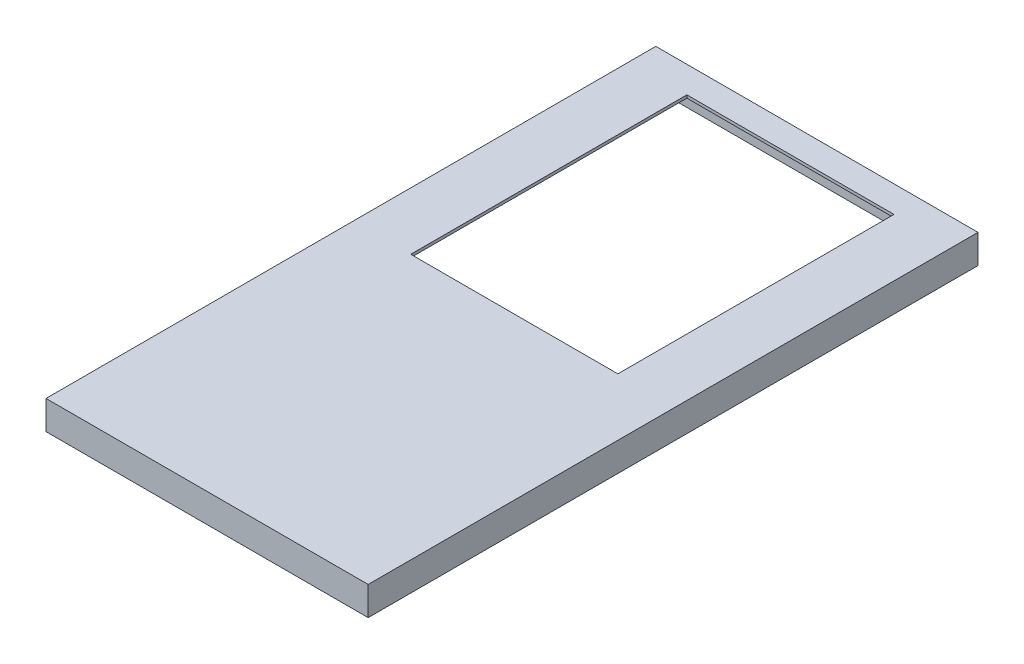
from build123d import *

# Parameters (mm, degrees)
SKETCH1_W                 = 56
SKETCH1_H                 = 106
BOSS_EXTRUDE1_DEPTH       = 5
SHELL1_T                  = -1.5
SHELL1_THICKNESS_2_FACE_W = 103
SHELL1_THICKNESS_2_FACE_H = 53
SHELL1_THICKNESS_2_DEPTH  = 1
SKETCH2_W                 = 36
SKETCH2_H                 = 48
CUT_EXTRUDE1_DEPTH        = 61.149812967
BOSS_EXTRUDE2_DEPTH       = 2.3
SKETCH4_R                 = 2.75
BOSS_EXTRUDE3_DEPTH       = 4.5
SKETCH5_R                 = 1.8
CUT_EXTRUDE2_DEPTH        = 4.5
MIRROR2_COPY_1_SKETCH_R   = 2.75
MIRROR2_COPY_1_DEPTH      = 4.5
MIRROR2_COPY_2_SKETCH_R   = 1.8
MIRROR2_COPY_2_DEPTH      = 4.5


with BuildPart() as part:
    # Sketch1 → Boss-Extrude1 (new body)
    with BuildSketch(Plane(origin=(0, 0, 0), x_dir=(1, 0, 0), z_dir=(0, 1, 0))):
        Rectangle(SKETCH1_W, SKETCH1_H)
    extrude(amount=-BOSS_EXTRUDE1_DEPTH)

    # Shell1
    shell1_openings = [part.faces().sort_by_distance(p)[0] for p in [
        (0, -5, 0),
    ]]
    offset(amount=SHELL1_T, openings=shell1_openings, kind=Kind.INTERSECTION)

    # Shell1 thickness 2 face (on inner face of the shell) → Shell1 thickness 2 (cut)
    with BuildSketch(Plane.ZX.offset(-1.5)):
        Rectangle(SHELL1_THICKNESS_2_FACE_W, SHELL1_THICKNESS_2_FACE_H)
    extrude(amount=SHELL1_THICKNESS_2_DEPTH, mode=Mode.SUBTRACT)

    # Sketch2 → Cut-Extrude1 (cut, through all)
    with BuildSketch(Plane(origin=(0, 0, 0), x_dir=(1, 0, 0), z_dir=(0, 1, 0))):
        with Locations((0, 24.4)):
            Rectangle(SKETCH2_W, SKETCH2_H)
    extrude(amount=-CUT_EXTRUDE1_DEPTH, mode=Mode.SUBTRACT)

    # Sketch3 → Boss-Extrude2 (add)
    with BuildSketch(Plane.XZ.offset(0.5)):
        Polygon((-21.6, -51.5), (21.6, -51.5), (21.6, 9.2), (18.1, 9.2), (18.1, 10.7), (23.1, 10.7), (23.1, -53), (-23.1, -53), (-23.1, 10.7), (-18.1, 10.7), (-18.1, 9.2), (-21.6, 9.2), align=None)
    extrude(amount=BOSS_EXTRUDE2_DEPTH)

    # Sketch4 → Boss-Extrude3 (add)
    with BuildSketch(Plane.XZ.offset(0.5)):
        with Locations((25.25, -50.25)):
            Circle(SKETCH4_R)
    boss_extrude3 = extrude(amount=BOSS_EXTRUDE3_DEPTH)

    # Sketch5 → Cut-Extrude2 (cut)
    with BuildSketch(Plane.XZ.offset(5)):
        with Locations(Location((25.25, -50.25, 0), (0, 0, 270))):
            Circle(SKETCH5_R)
    cut_extrude2 = extrude(amount=-CUT_EXTRUDE2_DEPTH, mode=Mode.SUBTRACT)

    # Mirror1: Boss-Extrude3, Cut-Extrude2 across plane
    add(boss_extrude3.mirror(Plane.XY))
    add(cut_extrude2.mirror(Plane.XY), mode=Mode.SUBTRACT)

    # Mirror2: Boss-Extrude3, Cut-Extrude2 across plane
    add(boss_extrude3.mirror(Plane(origin=(0, 0, 0), x_dir=(0, 0, 1), z_dir=(1, 0, 0))))
    add(cut_extrude2.mirror(Plane(origin=(0, 0, 0), x_dir=(0, 0, 1), z_dir=(1, 0, 0))), mode=Mode.SUBTRACT)

    # Mirror2 copy 1 sketch → Mirror2 copy 1 (add)
    with BuildSketch(Plane(origin=(0, -0.5, 0), x_dir=(-1, 0, 0), z_dir=(0, -1, 0))):
        with Locations((25.25, -50.25)):
            Circle(MIRROR2_COPY_1_SKETCH_R)
    extrude(amount=MIRROR2_COPY_1_DEPTH)

    # Mirror2 copy 2 sketch → Mirror2 copy 2 (cut)
    with BuildSketch(Plane(origin=(0, -5, 0), x_dir=(-1, 0, 0), z_dir=(0, -1, 0))):
        with Locations(Location((25.25, -50.25, 0), (0, 0, 270))):
            Circle(MIRROR2_COPY_2_SKETCH_R)
    extrude(amount=-MIRROR2_COPY_2_DEPTH, mode=Mode.SUBTRACT)


solid = part.part
